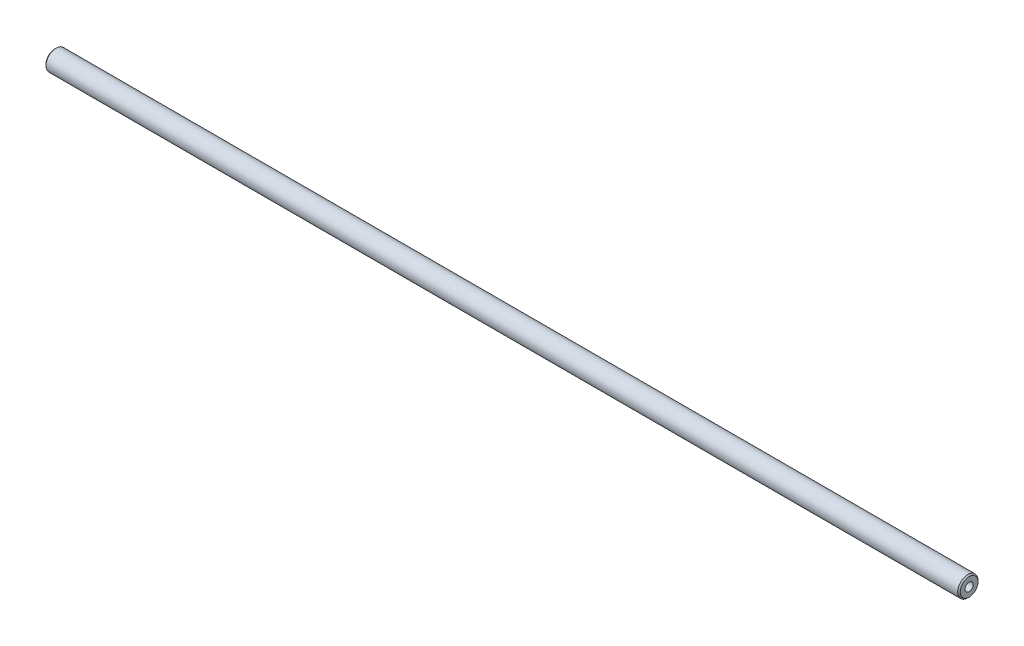
from build123d import *

# Parameters (mm, degrees)
SKETCH1_R                = 4
BOSS_EXTRUDE1_DEPTH      = 180
M3_CLEARANCE_HOLE1_D     = 3.242
M3_CLEARANCE_HOLE1_DEPTH = 15
M3_CLEARANCE_HOLE1_TIP   = 0.973995063
M3_CLEARANCE_HOLE2_D     = 3.242
M3_CLEARANCE_HOLE2_DEPTH = 15
M3_CLEARANCE_HOLE2_TIP   = 0.973995063
CHAMFER1_SIZE            = 0.5


with BuildPart() as part:
    # Sketch1 → Boss-Extrude1 (new, symmetric)
    with BuildSketch(Plane(origin=(0, 0, 0), x_dir=(0, -1, 0), z_dir=(-1, 0, 0))):
        with Locations(Location((0, 0, 0), (0, 0, 90))):
            Circle(SKETCH1_R)
    extrude(amount=BOSS_EXTRUDE1_DEPTH, both=True)

    # M3 Clearance Hole1
    with Locations(Plane(origin=(180, 0, 0), x_dir=(0, 0, -1), z_dir=(1, 0, 0))):
        with Locations((0, 0)):
            Hole(M3_CLEARANCE_HOLE1_D / 2, depth=M3_CLEARANCE_HOLE1_DEPTH)
            with Locations((0, 0, -(M3_CLEARANCE_HOLE1_DEPTH + M3_CLEARANCE_HOLE1_TIP / 2))):  # 118° drill point
                Cone(0, M3_CLEARANCE_HOLE1_D / 2, M3_CLEARANCE_HOLE1_TIP, mode=Mode.SUBTRACT)

    # M3 Clearance Hole2
    with Locations(Plane.ZY.offset(180)):
        with Locations((0, 0)):
            Hole(M3_CLEARANCE_HOLE2_D / 2, depth=M3_CLEARANCE_HOLE2_DEPTH)
            with Locations((0, 0, -(M3_CLEARANCE_HOLE2_DEPTH + M3_CLEARANCE_HOLE2_TIP / 2))):  # 118° drill point
                Cone(0, M3_CLEARANCE_HOLE2_D / 2, M3_CLEARANCE_HOLE2_TIP, mode=Mode.SUBTRACT)

    # Chamfer1
    chamfer1_edges = [part.edges().sort_by_distance(p)[0] for p in [
        (-180, 0, -4),
        (180, 0, -4),
    ]]
    chamfer(chamfer1_edges, length=CHAMFER1_SIZE)


solid = part.part
